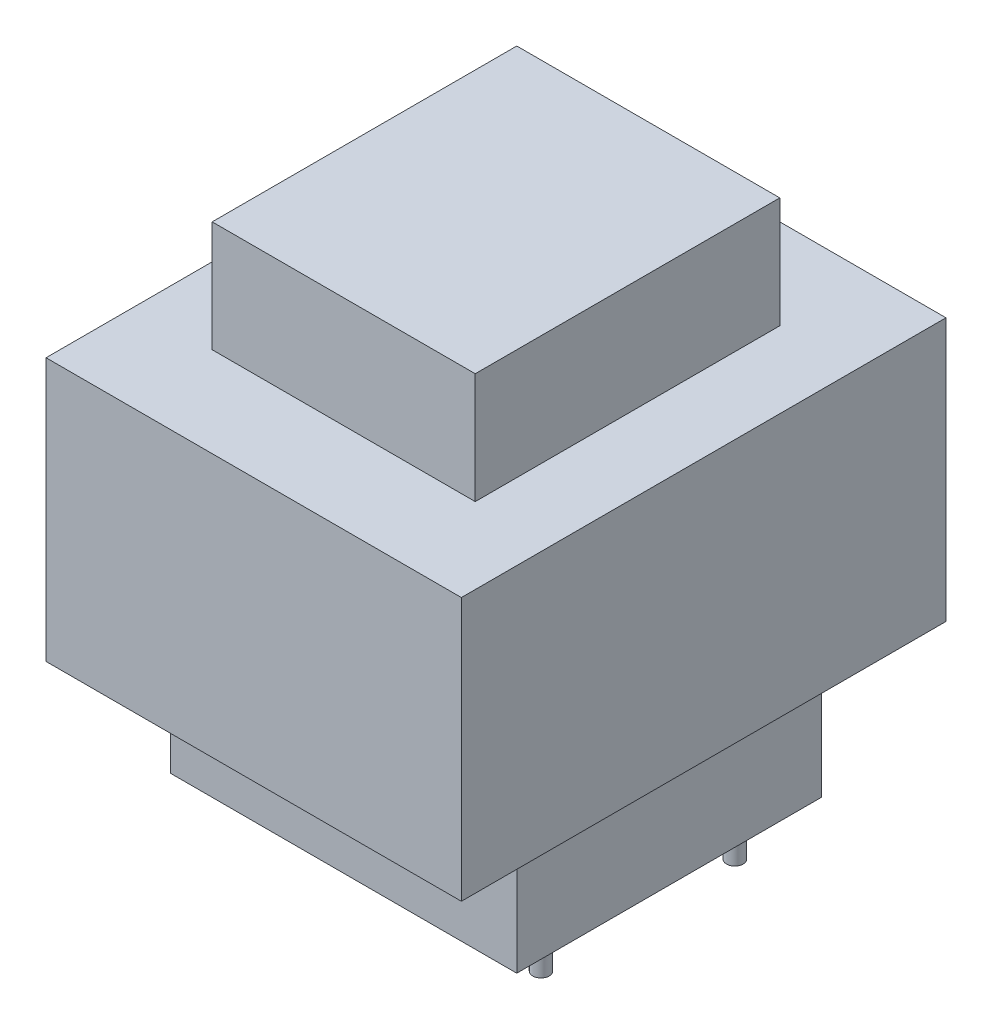
from build123d import *

# Parameters (mm, degrees)
SKETCH_1_W      = 25
SKETCH_1_H      = 22
EXTRUDE_1_DEPTH = 9
SKETCH_2_W      = 19
SKETCH_2_H      = 22
EXTRUDE_2_DEPTH = 27
SKETCH_4_R      = 0.6
EXTRUDE_4_DEPTH = 3
SKETCH_3_W      = 30
SKETCH_3_H      = 35
SKETCH_3_W_2    = 19
SKETCH_3_H_2    = 22
EXTRUDE_6_DEPTH = 19


with BuildPart() as part:
    # Эскиз1 → Бобышка-Вытянуть1 (new body)
    with BuildSketch(Plane(origin=(0, 0, 0), x_dir=(1, 0, 0), z_dir=(0, 1, 0))):
        Rectangle(SKETCH_1_W, SKETCH_1_H)
    extrude(amount=EXTRUDE_1_DEPTH)

    # Эскиз2 → Бобышка-Вытянуть2 (add)
    with BuildSketch(Plane(origin=(0, 9, 0), x_dir=(1, 0, 0), z_dir=(0, 1, 0))):
        Rectangle(SKETCH_2_W, SKETCH_2_H)
    extrude(amount=EXTRUDE_2_DEPTH)

    # Эскиз4 → Бобышка-Вытянуть4 (add)
    with BuildSketch(Plane.XZ):
        with Locations(Location((10.25, -7, 0), (0, 0, 270))):
            Circle(SKETCH_4_R)
        with Locations(Location((10.25, 7, 0), (0, 0, 270))):
            Circle(SKETCH_4_R)
        with Locations(Location((-10.25, 7, 0), (0, 0, 270))):
            Circle(SKETCH_4_R)
        with Locations(Location((-10.25, -7, 0), (0, 0, 270))):
            Circle(SKETCH_4_R)
        with Locations(Location((-10.25, 0, 0), (0, 0, 270))):
            Circle(SKETCH_4_R)
    extrude(amount=EXTRUDE_4_DEPTH)

    # Эскиз3 → Бобышка-Вытянуть6 (add)
    with BuildSketch(Plane(origin=(0, 9, 0), x_dir=(1, 0, 0), z_dir=(0, 1, 0))):
        Rectangle(SKETCH_3_W, SKETCH_3_H)
        Rectangle(SKETCH_3_W_2, SKETCH_3_H_2, mode=Mode.SUBTRACT)
    extrude(amount=EXTRUDE_6_DEPTH)


solid = part.part
